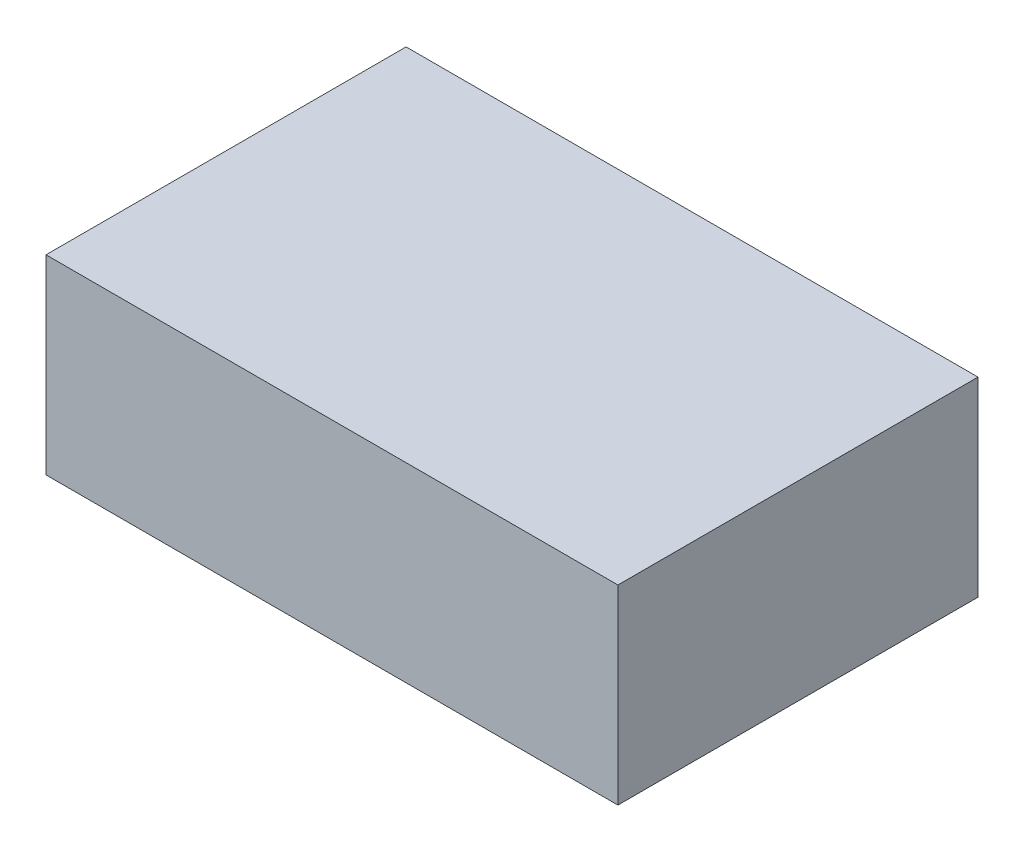
from build123d import *

# Parameters (mm, degrees)
CROQUIS2_W              = 135
CROQUIS2_H              = 85
SALIENTE_EXTRUIR2_DEPTH = 45


with BuildPart() as part:
    # Croquis2 → Saliente-Extruir2 (new body)
    with BuildSketch(Plane(origin=(0, 0, 0), x_dir=(1, 0, 0), z_dir=(0, 1, 0))):
        Rectangle(CROQUIS2_W, CROQUIS2_H)
    extrude(amount=SALIENTE_EXTRUIR2_DEPTH)


solid = part.part
